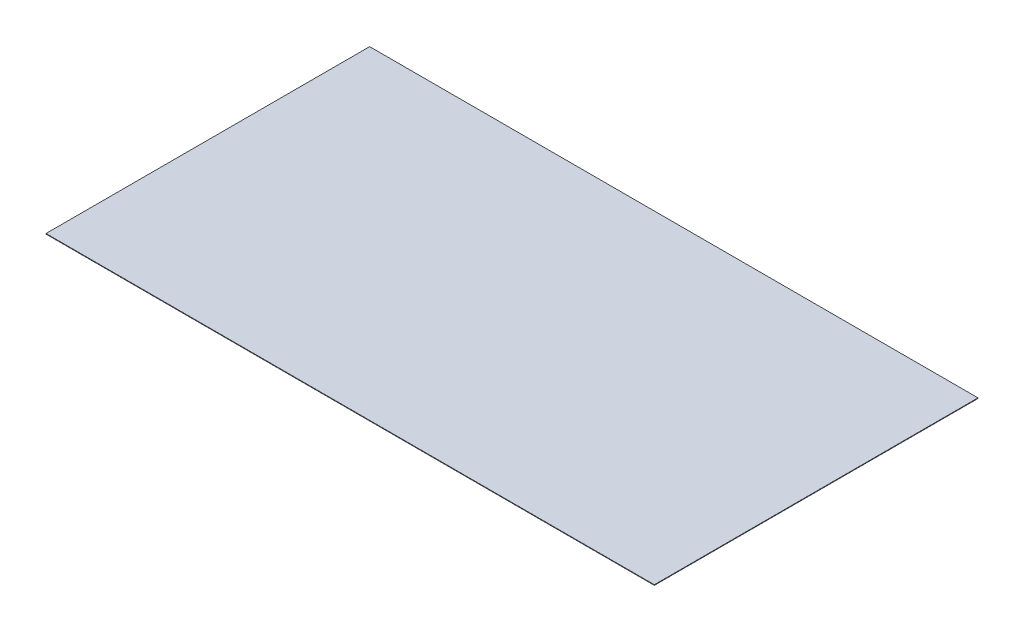
from build123d import *

# Parameters (mm, degrees)
CROQUIS1_W     = 2188
CROQUIS1_H     = 1164
EXTRUIR1_DEPTH = 2


with BuildPart() as part:
    # Croquis1 → Extruir1 (new body)
    with BuildSketch(Plane(origin=(0, 0, 0), x_dir=(1, 0, 0), z_dir=(0, 1, 0))):
        Rectangle(CROQUIS1_W, CROQUIS1_H)
    extrude(amount=EXTRUIR1_DEPTH)


solid = part.part
